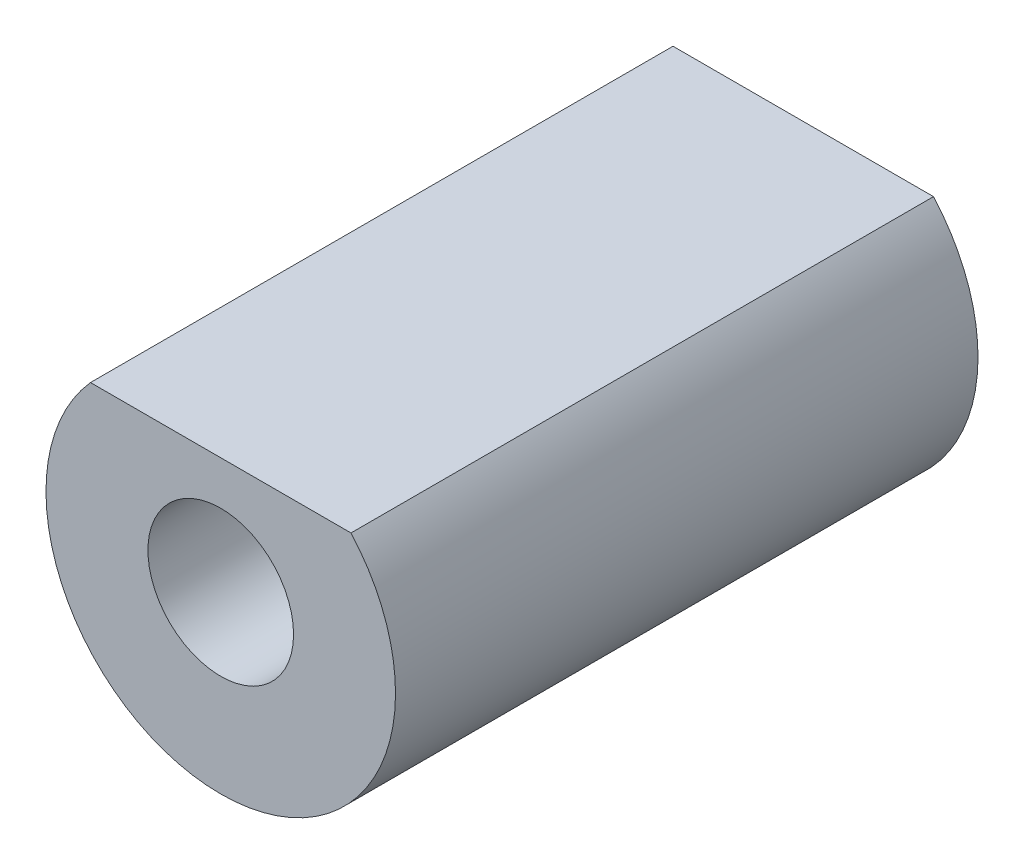
from build123d import *

# Parameters (mm, degrees)
SKETCH1_R           = 1.25
BOSS_EXTRUDE1_DEPTH = 10


with BuildPart() as part:
    # Sketch1 → Boss-Extrude1 (new body)
    with BuildSketch(Plane.XY):
        with BuildLine():
            Line((-2.236067977, 2), (2.236067977, 2))
            ThreePointArc((2.236067977, 2), (0, -3), (-2.236067977, 2))
        make_face()
        Circle(SKETCH1_R, mode=Mode.SUBTRACT)
    extrude(amount=BOSS_EXTRUDE1_DEPTH)


solid = part.part
